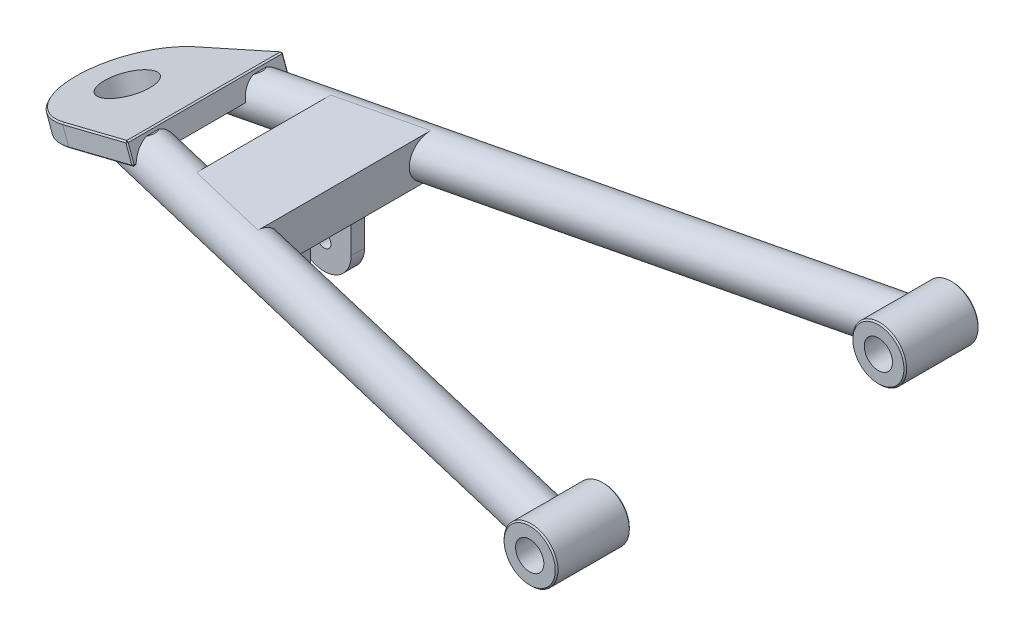
from build123d import *
from OCP.BRepFilletAPI import BRepFilletAPI_MakeChamfer

# Parameters (mm, degrees)
SKETCH1_W                            = 9.5
SKETCH1_H                            = 55
BOSS_EXTRUDE1_REACH                  = 497.037
BOSS_EXTRUDE1_END_RADIUS             = 20
SKETCH2_R                            = 15.5
SKETCH2_R_2                          = 12.65
BOSS_EXTRUDE2_REACH                  = 497.037
BOSS_EXTRUDE2_END_RADIUS             = 20
SKETCH3_R                            = 15.5
SKETCH3_R_2                          = 12.65
SKETCH9_W                            = 200
SKETCH9_H                            = 33.234380704
CUT_EXTRUDE2_DEPTH                   = 198.5
SKETCH8_R                            = 18
BOSS_EXTRUDE3_DEPTH                  = 15
CHAMFER1_SIZE                        = 1
CHAMFER2_SIZE                        = 1
CHAMFER2_SIZE2                       = 0.883191486
BOSS_EXTRUDE5_REACH                  = 511.879
BOSS_EXTRUDE5_END_RADIUS             = 15.5
SKETCH13_W                           = 60
SKETCH13_H                           = 31
BOSS_EXTRUDE5_DIRECTION_2_REACH      = 511.879
BOSS_EXTRUDE5_DIRECTION_2_END_RADIUS = 15.5
CHAMFER4_SIZE                        = 1
SKETCH19_R                           = 5
BOSS_EXTRUDE7_DEPTH                  = 10


with BuildPart() as part:
    # Sketch1 → Revolve1 (revolve)
    with BuildSketch(Plane(origin=(0, 0, 0), x_dir=(1, 0, 0), z_dir=(0, 1, 0)), mode=Mode.PRIVATE) as revolve1_sk:
        with Locations((-4.75, 129.48)):
            Rectangle(SKETCH1_W, SKETCH1_H)
        with Locations((-4.75, -129.48)):
            Rectangle(SKETCH1_W, SKETCH1_H)
    revolve(revolve1_sk.sketch.rotate(Axis((10.5, 0, -101.98), (0, 0, -1)), 180), axis=Axis((10.5, 0, -101.98), (0, 0, -1)))

    # Boss-Extrude1: up to this cylinder (the profile starts outside it)
    boss_extrude1_end = Plane(origin=(10.5, 0, -44.652226), z_dir=(0, 0, 1)) * Cylinder(BOSS_EXTRUDE1_END_RADIUS, 1035.074, mode=Mode.PRIVATE)
    # Sketch2 → Boss-Extrude1 (add, up to the surface)
    with BuildSketch(Plane(origin=(-427.43, 0, -30), x_dir=(0.2315607356536785, 0, 0.9728204488514453), z_dir=(-0.9728204488514451, 0, 0.23156073565367846)), mode=Mode.PRIVATE) as boss_extrude1_sk1:
        Circle(SKETCH2_R)
        Circle(SKETCH2_R_2, mode=Mode.SUBTRACT)
    boss_extrude1_tool1 = extrude(boss_extrude1_sk1.sketch, amount=-BOSS_EXTRUDE1_REACH, mode=Mode.PRIVATE) - boss_extrude1_end
    add(boss_extrude1_tool1.solids().sort_by_distance((-430.917674, 0, -44.652226))[0])

    # Boss-Extrude2: up to this cylinder (the profile starts outside it)
    boss_extrude2_end = Plane(origin=(10.5, 0, 15.347774), z_dir=(0, 0, 1)) * Cylinder(BOSS_EXTRUDE2_END_RADIUS, 1035.074, mode=Mode.PRIVATE)
    # Sketch3 → Boss-Extrude2 (add, up to the surface)
    with BuildSketch(Plane(origin=(-427.43, 0, 30), x_dir=(-0.23156073565367818, 0, 0.9728204488514453), z_dir=(-0.9728204488514453, 0, -0.23156073565367818)), mode=Mode.PRIVATE) as boss_extrude2_sk1:
        Circle(SKETCH3_R)
        Circle(SKETCH3_R_2, mode=Mode.SUBTRACT)
    boss_extrude2_tool1 = extrude(boss_extrude2_sk1.sketch, amount=-BOSS_EXTRUDE2_REACH, mode=Mode.PRIVATE) - boss_extrude2_end
    add(boss_extrude2_tool1.solids().sort_by_distance((-423.942326, 0, 15.347774))[0])

    # Sketch9 → Cut-Extrude2 (cut, symmetric)
    with BuildSketch(Plane(origin=(-377.430188161, -137.373354004, 0), x_dir=(0, 0, 1), z_dir=(-0.9396926207859128, -0.34202014332565694, 0))):
        with Locations((0, 162.806860214)):
            Rectangle(SKETCH9_W, SKETCH9_H)
    extrude(amount=CUT_EXTRUDE2_DEPTH, both=True, mode=Mode.SUBTRACT)

    # Sketch8 → Boss-Extrude3 (add)
    with BuildSketch(Plane(origin=(-45.934180208, 126.203122901, 0), x_dir=(0, 0, -1), z_dir=(-0.34202014332565694, 0.9396926207859128, 1.048381213421869e-15))):
        with BuildLine():
            Line((-58.125498382, 358.322816903), (58.125498382, 358.322816903))
            Line((58.125498382, 358.322816903), (49.490055464, 418.322816903))
            ThreePointArc((49.490055464, 418.322816903), (0, 461.200007753), (-49.490055464, 418.322816903))
            Line((-49.490055464, 418.322816903), (-58.125498382, 358.322816903))
        make_face()
        with Locations(Location((0, 419.652816903, 0), (0, 0, 90))):
            Circle(SKETCH8_R, mode=Mode.SUBTRACT)
    extrude(amount=BOSS_EXTRUDE3_DEPTH)

    # Chamfer1
    chamfer1_edges = [part.edges().sort_by_distance(p)[0] for p in [
        (-9.5, 0, -156.98),
        (-9.5, 0, -101.98),
        (-9.5, 0, 101.98),
        (-9.5, 0, 156.98),
    ]]
    chamfer(chamfer1_edges, length=CHAMFER1_SIZE)

    # Chamfer2: one chamfer whose edges measure the first distance from different faces: ONE call of the kernel's chamfer builder (chamfer() names one face for all edges)
    chamfer2_edges_1 = [part.edges().sort_by_distance(p)[0] for p in [
        (-385.212638185, 10.697196363, 58.125498382),
    ]]
    chamfer2_side_1 = [part.faces().sort_by_distance(p)[0] for p in [
        (-413.403416809, 0.436592064, 53.807776923),
    ]]
    chamfer2_edges_2 = [part.edges().sort_by_distance(p)[0] for p in [
        (-385.212638185, 10.697196363, -58.125498382),
    ]]
    chamfer2_side_2 = [part.faces().sort_by_distance(p)[0] for p in [
        (-385.604654849, 11.774253296, 0),
    ]]
    chamfer2_edges_3 = [part.edges().sort_by_distance(p)[0] for p in [
        (-387.77778926, 17.744891019, 0),
        (-415.968567884, 7.48428672, 53.807776923),
        (-415.968567884, 7.48428672, -53.807776923),
        (-484.450726349, -17.44118054, 0),
        (-382.64748711, 3.649501708, 57.135102558),
        (-410.838265734, -6.611102592, 53.807776923),
        (-410.838265734, -6.611102592, -53.807776923),
        (-479.320424199, -31.536569852, 0),
        (-382.64748711, 3.649501708, -57.135102558),
    ]]
    chamfer2 = BRepFilletAPI_MakeChamfer(part.part.solid().wrapped)
    for e in chamfer2_edges_1:
        chamfer2.Add(CHAMFER2_SIZE, CHAMFER2_SIZE2, e.wrapped, chamfer2_side_1[0].wrapped)  # the first distance lies on this face
    for e in chamfer2_edges_2:
        chamfer2.Add(CHAMFER2_SIZE, CHAMFER2_SIZE2, e.wrapped, chamfer2_side_2[0].wrapped)  # the first distance lies on this face
    for e in chamfer2_edges_3:
        chamfer2.Add(CHAMFER2_SIZE, e.wrapped)
    add(Compound.cast(chamfer2.Shape()), mode=Mode.REPLACE)

    # Boss-Extrude5: up to this cylinder (the profile starts outside it)
    boss_extrude5_end = Plane(origin=(-326.943046764, 0, 53.918938836), z_dir=(-0.9728204488514453, 0, -0.2315607356536782)) * Cylinder(BOSS_EXTRUDE5_END_RADIUS, 1055.758, mode=Mode.PRIVATE)
    # Sketch13 → Boss-Extrude5 (add, up to the surface)
    with BuildSketch(Plane.XY, mode=Mode.PRIVATE) as boss_extrude5_sk1:
        with Locations((-314.108706206, 0)):
            Rectangle(SKETCH13_W, SKETCH13_H)
    boss_extrude5_tool1 = extrude(boss_extrude5_sk1.sketch, amount=BOSS_EXTRUDE5_REACH, mode=Mode.PRIVATE) - boss_extrude5_end
    add(boss_extrude5_tool1.solids().sort_by_distance((-314.108706, 0, 0))[0])

    # Boss-Extrude5 direction 2: up to this cylinder (the profile starts outside it)
    boss_extrude5_direction_2_end = Plane(origin=(-326.943046764, 0, -53.918938836), z_dir=(-0.9728204488514453, 0, 0.2315607356536785)) * Cylinder(BOSS_EXTRUDE5_DIRECTION_2_END_RADIUS, 1055.758, mode=Mode.PRIVATE)
    # Sketch13 → Boss-Extrude5 direction 2 (add, up to the surface)
    with BuildSketch(Plane.XY, mode=Mode.PRIVATE) as boss_extrude5_direction_2_sk1:
        with Locations((-314.108706206, 0)):
            Rectangle(SKETCH13_W, SKETCH13_H)
    boss_extrude5_direction_2_tool1 = extrude(boss_extrude5_direction_2_sk1.sketch, amount=-BOSS_EXTRUDE5_DIRECTION_2_REACH, mode=Mode.PRIVATE) - boss_extrude5_direction_2_end
    add(boss_extrude5_direction_2_tool1.solids().sort_by_distance((-314.108706, 0, 0))[0])

    # Chamfer4
    chamfer4_edges = [part.edges().sort_by_distance(p)[0] for p in [
        (-427.12856728, -15.445240802, -28.733637145),
        (-427.12856728, -15.445240802, 28.733637145),
    ]]
    chamfer(chamfer4_edges, length=CHAMFER4_SIZE)

    # Sketch19 → Boss-Extrude7 (add)
    with BuildSketch(Plane.XY.offset(15)):
        with BuildLine():
            Line((-334.108706206, -15.5), (-334.108706206, -45.5))
            ThreePointArc((-334.108706206, -45.5), (-314.108706206, -65.5), (-294.108706206, -45.5))
            Line((-294.108706206, -45.5), (-294.108706206, -15.5))
            Line((-294.108706206, -15.5), (-334.108706206, -15.5))
        make_face()
        with Locations((-314.108706206, -45.5)):
            Circle(SKETCH19_R, mode=Mode.SUBTRACT)
    boss_extrude7 = extrude(amount=BOSS_EXTRUDE7_DEPTH)

    # Mirror2: Boss-Extrude7 across plane
    add(boss_extrude7.mirror(Plane.XY))


solid = part.part
